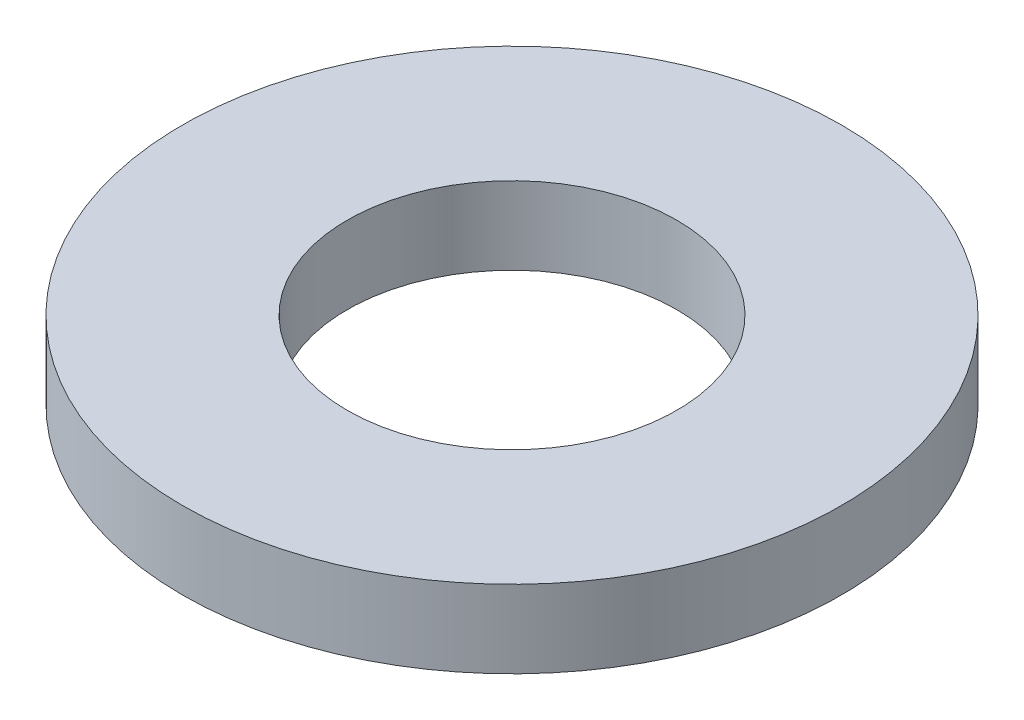
from build123d import *

# Parameters (mm, degrees)
SKETCH1_R           = 8.5
SKETCH1_R_2         = 4.25
BOSS_EXTRUDE1_DEPTH = 2


with BuildPart() as part:
    # Sketch1 → Boss-Extrude1 (new body)
    with BuildSketch(Plane(origin=(0, 0, 0), x_dir=(1, 0, 0), z_dir=(0, 1, 0))):
        with Locations(Location((0, 0, 0), (0, 0, 270))):
            Circle(SKETCH1_R)
        with Locations(Location((0, 0, 0), (0, 0, 270))):
            Circle(SKETCH1_R_2, mode=Mode.SUBTRACT)
    extrude(amount=BOSS_EXTRUDE1_DEPTH)


solid = part.part
